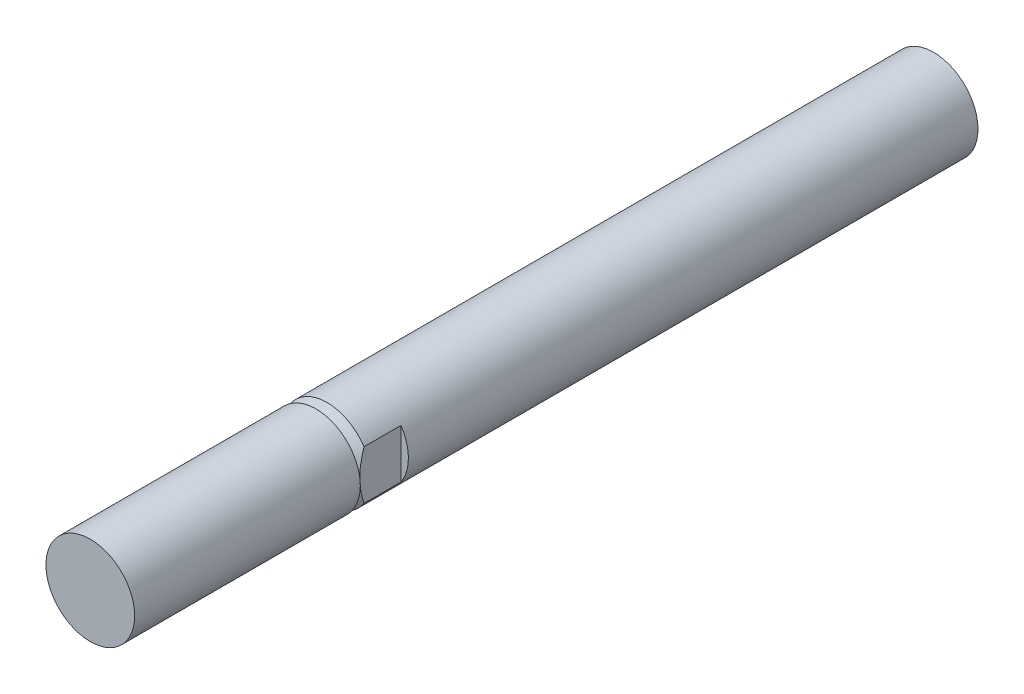
from build123d import *

# Parameters (mm, degrees)
SKETCH3_R          = 3
BODY_DEPTH         = 57
CUT_KEY_DEPTH      = 58.15767665
CUT_KEY_DEPTH_BACK = 58.15767665
SKETCH7_W          = 2.875
SKETCH7_H          = 2.875


with BuildPart() as part:
    # Sketch3 → body (new body)
    with BuildSketch(Plane.XY):
        Circle(SKETCH3_R)
    extrude(amount=-BODY_DEPTH)

    # Sketch5 → cut-thread (revolve, cut)
    with BuildSketch(Plane(origin=(0, 0, 0), x_dir=(0, 0, -1), z_dir=(1, 0, 0)), mode=Mode.PRIVATE) as cut_thread_sk:
        Polygon((15.625, 2.350480947), (16, 3), (16, 5.821231691), (0, 5.821231691), (0, 3), (15.25, 3), align=None)
    revolve(cut_thread_sk.sketch.rotate(Axis((0, 0, 0), (0, 0, -1)), 90), axis=Axis((0, 0, 0), (0, 0, -1)), mode=Mode.SUBTRACT)

    # Sketch7 → cut-key (cut, two sides: drawn at the far end of the back side and taken through both)
    with BuildSketch(Plane(origin=(0, 0, 0), x_dir=(1, 0, 0), z_dir=(0, 1, 0)).offset(-CUT_KEY_DEPTH_BACK)):
        with Locations((3.9375, 17.0625)):
            Rectangle(SKETCH7_W, SKETCH7_H)
        with Locations((-3.9375, 17.0625)):
            Rectangle(SKETCH7_W, SKETCH7_H)
    extrude(amount=CUT_KEY_DEPTH + CUT_KEY_DEPTH_BACK, mode=Mode.SUBTRACT)


solid = part.part
